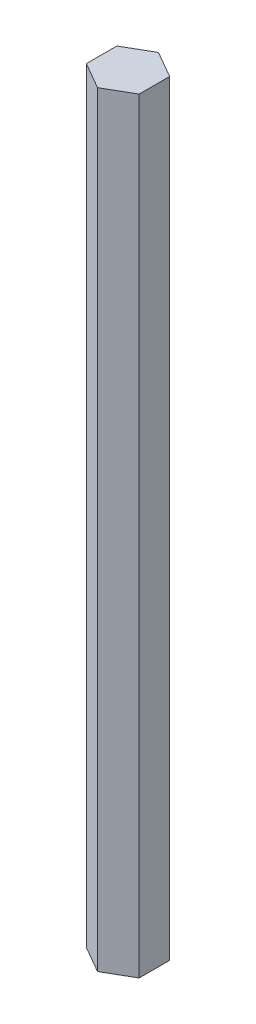
from build123d import *

# Parameters (mm, degrees)
BOSS_EXTRUDE1_DEPTH = 184.15


with BuildPart() as part:
    # Sketch1 → Boss-Extrude1 (new body)
    with BuildSketch(Plane(origin=(0, 0, 0), x_dir=(1, 0, 0), z_dir=(0, 1, 0))):
        Polygon((0, 7.332348419), (-6.35, 3.666174209), (-6.35, -3.666174209), (0, -7.332348419), (6.35, -3.666174209), (6.35, 3.666174209), align=None)
    extrude(amount=BOSS_EXTRUDE1_DEPTH)


solid = part.part
